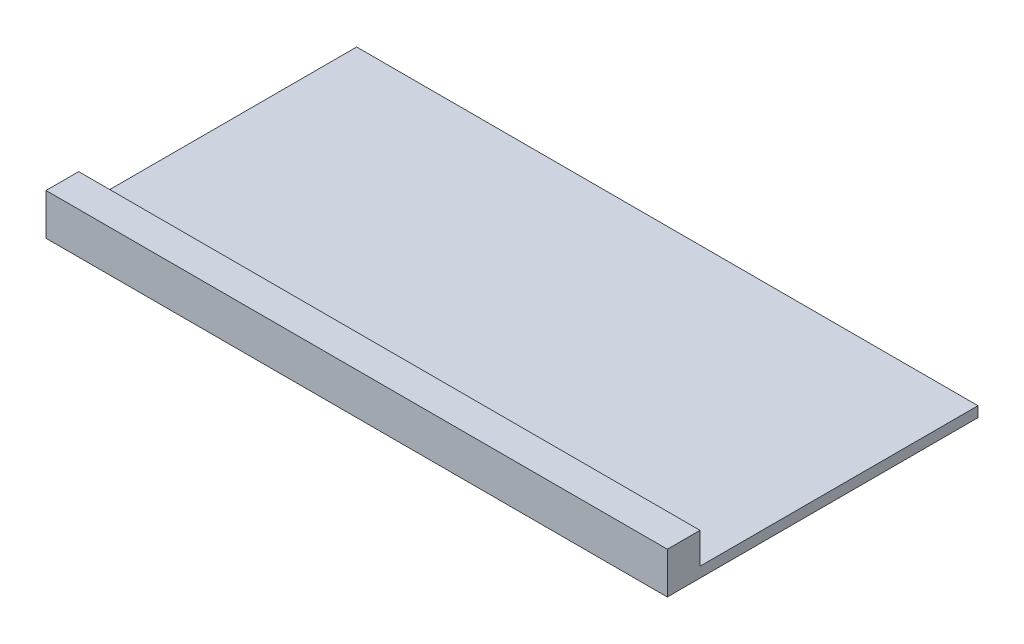
from build123d import *

# Parameters (mm, degrees)
SKETCH1_W           = 300
SKETCH1_H           = 150
BOSS_EXTRUDE1_DEPTH = 5
SKETCH2_W           = 300
SKETCH2_H           = 15.775995622
BOSS_EXTRUDE2_DEPTH = 15


with BuildPart() as part:
    # Sketch1 → Boss-Extrude1 (new body)
    with BuildSketch(Plane(origin=(0, 0, 0), x_dir=(1, 0, 0), z_dir=(0, 1, 0))):
        Rectangle(SKETCH1_W, SKETCH1_H)
    extrude(amount=BOSS_EXTRUDE1_DEPTH)

    # Sketch2 → Boss-Extrude2 (add)
    with BuildSketch(Plane(origin=(0, 5, 0), x_dir=(1, 0, 0), z_dir=(0, 1, 0))):
        with Locations((0, -67.112002189)):
            Rectangle(SKETCH2_W, SKETCH2_H)
    extrude(amount=BOSS_EXTRUDE2_DEPTH)


solid = part.part
